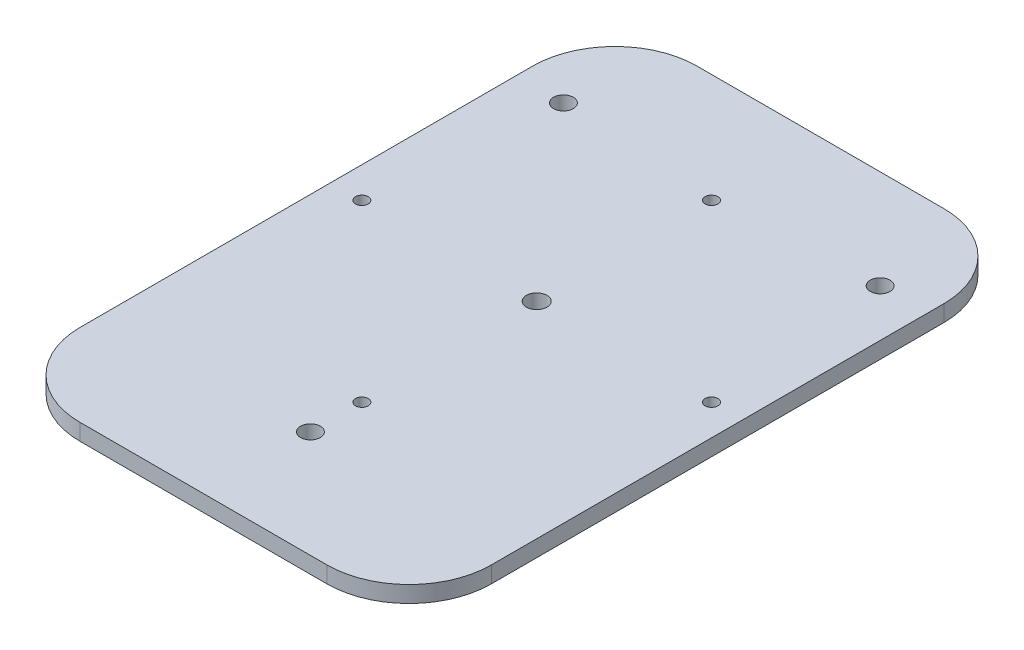
from build123d import *

# Parameters (mm, degrees)
ESBO_O1_R                = 2.5
ESBO_O1_R_2              = 2.4
ESBO_O1_R_3              = 1.55
RESSALTO_EXTRUS_O1_DEPTH = 4


with BuildPart() as part:
    # Esboço1 → Ressalto-extrusão1 (new body)
    with BuildSketch(Plane(origin=(0, 0, 0), x_dir=(1, 0, 0), z_dir=(0, 1, 0))):
        with BuildLine():
            Line((-30.381198383, -73.856404852), (29.618801617, -73.856404852))
            ThreePointArc((29.618801617, -73.856404852), (43.760937241, -67.998540476), (49.618801617, -53.856404852))
            Line((49.618801617, -53.856404852), (49.618801617, 56.143595148))
            ThreePointArc((49.618801617, 56.143595148), (43.760937241, 70.285730771), (29.618801617, 76.143595148))
            Line((29.618801617, 76.143595148), (-30.381198383, 76.143595148))
            ThreePointArc((-30.381198383, 76.143595148), (-44.523334006, 70.285730771), (-50.381198383, 56.143595148))
            Line((-50.381198383, 56.143595148), (-50.381198383, -53.856404852))
            ThreePointArc((-50.381198383, -53.856404852), (-44.523334006, -67.998540476), (-30.381198383, -73.856404852))
        make_face()
        with Locations(Location((-0.381198383, 7.143595148, 0), (0, 0, 270))):
            Circle(ESBO_O1_R, mode=Mode.SUBTRACT)
        with Locations(Location((38.118801617, 52.143595148, 0), (0, 0, 270))):
            Circle(ESBO_O1_R_2, mode=Mode.SUBTRACT)
        with Locations(Location((-38.881198383, 52.143595148, 0), (0, 0, 270))):
            Circle(ESBO_O1_R_2, mode=Mode.SUBTRACT)
        with Locations(Location((-0.381198383, -47.856404852, 0), (0, 0, 270))):
            Circle(ESBO_O1_R_2, mode=Mode.SUBTRACT)
        with Locations(Location((-42.881198383, 7.143595148, 0), (0, 0, 270))):
            Circle(ESBO_O1_R_3, mode=Mode.SUBTRACT)
        with Locations(Location((42.118801617, 7.143595148, 0), (0, 0, 270))):
            Circle(ESBO_O1_R_3, mode=Mode.SUBTRACT)
        with Locations(Location((-0.381198383, -35.356404852, 0), (0, 0, 270))):
            Circle(ESBO_O1_R_3, mode=Mode.SUBTRACT)
        with Locations(Location((-0.381198383, 49.643595148, 0), (0, 0, 270))):
            Circle(ESBO_O1_R_3, mode=Mode.SUBTRACT)
    extrude(amount=RESSALTO_EXTRUS_O1_DEPTH)


solid = part.part
